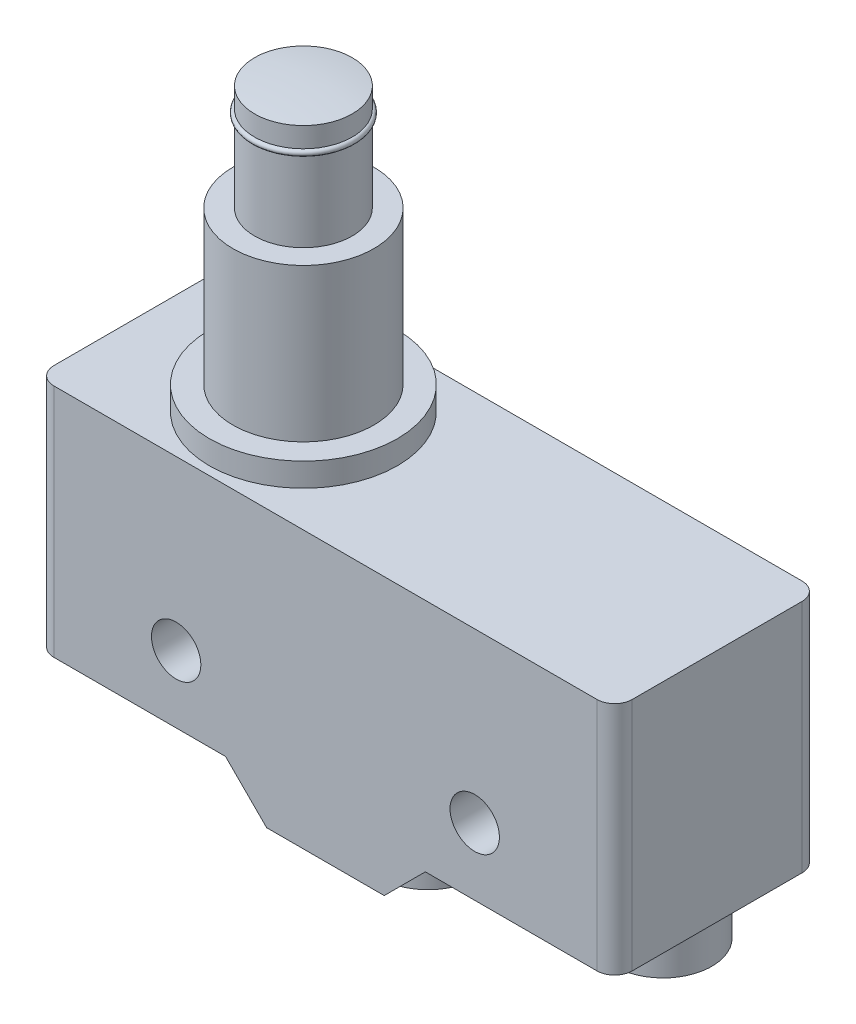
from build123d import *

# Parameters (mm, degrees)
SKETCH_1_R      = 2.1
EXTRUDE_1_DEPTH = 17.45
SKETCH_2_R      = 4.15
EXTRUDE_2_DEPTH = 3.5
SKETCH_3_R      = 4.15
EXTRUDE_3_DEPTH = 3.5
FILLET_1_R      = 1.5


with BuildPart() as part:
    # ｽｹｯﾁ1 → ﾎﾞｽ - 押し出し1 (new body)
    with BuildSketch(Plane.XY):
        Polygon((-5, -13.5), (5, -13.5), (8.5, -10), (24.6, -10), (24.6, 10), (-24.6, 10), (-24.6, -10), (-8.5, -10), align=None)
        with Locations((-12.7, -4.3)):
            Circle(SKETCH_1_R, mode=Mode.SUBTRACT)
        with Locations(Location((12.7, -4.3, 0), (0, 0, 180))):
            Circle(SKETCH_1_R, mode=Mode.SUBTRACT)
    extrude(amount=EXTRUDE_1_DEPTH)

    # ｽｹｯﾁ2 → ﾎﾞｽ - 押し出し2 (add)
    with BuildSketch(Plane.XZ.offset(10)):
        with Locations(Location((-20, 8.725, 0), (0, 0, 180))):
            Circle(SKETCH_2_R)
        with Locations(Location((20, 8.725, 0), (0, 0, 180))):
            Circle(SKETCH_2_R)
    extrude(amount=EXTRUDE_2_DEPTH)

    # ｽｹｯﾁ3 → ﾎﾞｽ - 押し出し3 (add)
    with BuildSketch(Plane.XZ.offset(13.5)):
        with Locations(Location((0, 8.725, 0), (0, 0, 180))):
            Circle(SKETCH_3_R)
    extrude(amount=EXTRUDE_3_DEPTH)

    # ｽｹｯﾁ5 → 回転1 (revolve)
    with BuildSketch(Plane.XY.offset(8.725)):
        with BuildLine():
            Line((-10.6, 10), (-18.6, 10))
            Line((-18.6, 10), (-18.6, 12))
            Line((-18.6, 12), (-16.6, 12))
            Line((-16.6, 12), (-16.6, 25))
            Line((-16.6, 25), (-14.75, 25))
            Line((-14.75, 25), (-14.75, 31.78842818))
            ThreePointArc((-14.75, 31.78842818), (-15, 32.03842818), (-14.75, 32.28842818))
            Line((-14.75, 32.28842818), (-14.75, 34))
            ThreePointArc((-14.75, 34), (-12.680005458, 34.216234269), (-10.6, 34.28842818))
            Line((-10.6, 34.28842818), (-10.6, 34))
            Line((-10.6, 34), (-10.6, 10))
        make_face()
    revolve(axis=Axis((-10.6, 27.136449726, 8.725), (0, -1, 0)))

    # ﾌｨﾚｯﾄ1
    fillet_1_edges = [part.edges().sort_by_distance(p)[0] for p in [
        (24.6, 0, 17.45),
        (-24.6, 0, 17.45),
        (-24.6, 0, 0),
        (24.6, 0, 0),
    ]]
    fillet(fillet_1_edges, radius=FILLET_1_R)


solid = part.part
